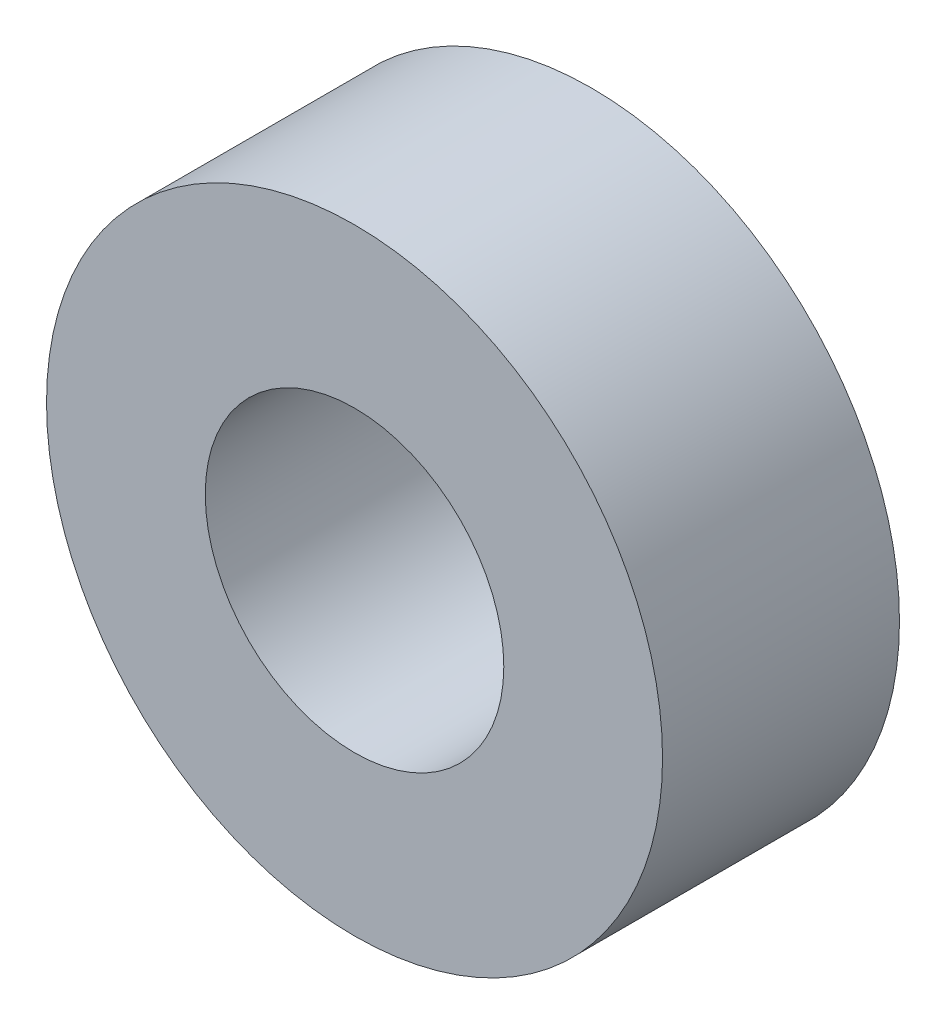
from build123d import *

# Parameters (mm, degrees)
SKETCH1_R      = 6.5
SKETCH1_R_2    = 3.15
EXTRUDE1_DEPTH = 2.5


with BuildPart() as part:
    # Sketch1 → Extrude1 (new, symmetric)
    with BuildSketch(Plane.XY):
        Circle(SKETCH1_R)
        Circle(SKETCH1_R_2, mode=Mode.SUBTRACT)
    extrude(amount=EXTRUDE1_DEPTH, both=True)


solid = part.part
